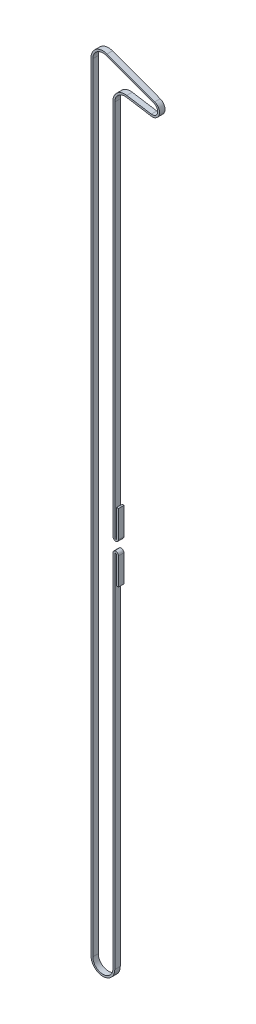
from build123d import *

# Parameters (mm, degrees)
BOSS_EXTRUDE1_DEPTH = 6


with BuildPart() as part:
    # Sketch1 → Boss-Extrude1 (new body)
    with BuildSketch(Plane.XY):
        with BuildLine():
            Line((0, 0), (0, 100))
            Line((0, 100), (0, 116.099356626))
            ThreePointArc((0, 116.099356626), (5.566363801, 126.764301673), (17.498623517, 128.296175326))
            Line((17.498623517, 128.296175326), (69.668134054, 109.054191593))
            ThreePointArc((69.668134054, 109.054191593), (74.638707981, 99.521504918), (65.633362838, 93.649326508))
            Line((65.633362838, 93.649326508), (38.741282829, 97.960661065))
            ThreePointArc((38.741282829, 97.960661065), (29.863968579, 95.470560576), (25.999999999, 87.099356626))
            Line((25.999999999, 87.099356626), (25.999999999, -325.14105767))
            ThreePointArc((25.999999999, -325.14105767), (26.999999698, -326.141057369), (27.999999397, -325.14105767))
            Line((27.999999397, -325.14105767), (27.999999397, -295.628663382))
            Line((27.999999397, -295.628663382), (29.999999399, -295.628663382))
            Line((29.999999399, -295.628663382), (29.999999399, -325.14105767))
            ThreePointArc((29.999999399, -325.14105767), (26.999999699, -328.14105737), (23.999999999, -325.14105767))
            Line((23.999999999, -325.14105767), (23.999999999, 87.099356626))
            ThreePointArc((23.999999999, 87.099356626), (28.56650832, 96.992597657), (39.057879707, 99.93544369))
            Line((39.057879707, 99.93544369), (65.949959716, 95.624109133))
            ThreePointArc((65.949959716, 95.624109133), (72.703968573, 100.02824294), (68.976038128, 107.177757947))
            Line((68.976038128, 107.177757947), (16.806527591, 126.41974168))
            ThreePointArc((16.806527591, 126.41974168), (6.710000139, 125.123540896), (2, 116.099356626))
            Line((2, 116.099356626), (2, 100))
            Line((2, 100), (2, 0))
            Line((2, 0), (2, -733.96669053))
            ThreePointArc((2, -733.96669053), (13, -744.96669053), (24, -733.96669053))
            Line((24, -733.96669053), (24, -340.488878189))
            ThreePointArc((24, -340.488878189), (26.9999997, -337.488878489), (29.9999994, -340.488878189))
            Line((29.9999994, -340.488878189), (29.9999994, -370.001272476))
            Line((29.9999994, -370.001272476), (27.999999398, -370.001272476))
            Line((27.999999398, -370.001272476), (27.999999398, -340.488878189))
            ThreePointArc((27.999999398, -340.488878189), (26.999999699, -339.48887849), (26, -340.488878189))
            Line((26, -340.488878189), (26, -733.96669053))
            ThreePointArc((26, -733.96669053), (13, -746.96669053), (0, -733.96669053))
            Line((0, -733.96669053), (0, 0))
        make_face()
    extrude(amount=BOSS_EXTRUDE1_DEPTH)


solid = part.part
